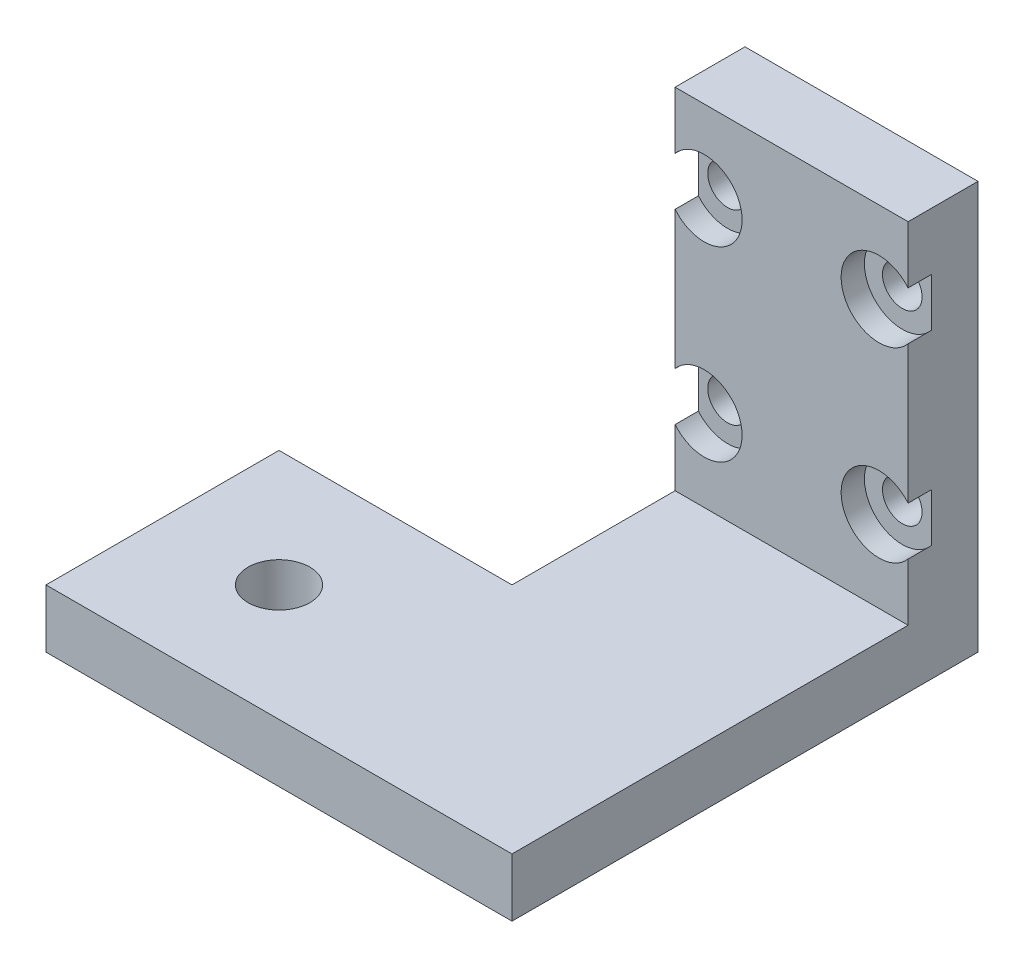
from build123d import *

# Parameters (mm, degrees)
BOSS_EXTRUDE1_DEPTH                                  = 5
SKETCH2_W                                            = 20
SKETCH2_H                                            = 6
BOSS_EXTRUDE2_DEPTH                                  = 30
SKETCH3_R                                            = 1.5
CUT_EXTRUDE1_DEPTH                                   = 50.558046773
REFRENTADO_PARA_TORNILLO_CON_CABEZA_PLAN_D           = 3.4
REFRENTADO_PARA_TORNILLO_CON_CABEZA_PLAN_CBORE_D     = 6.5
REFRENTADO_PARA_TORNILLO_CON_CABEZA_PLAN_CBORE_DEPTH = 2
CUT_EXTRUDE2_REACH                                   = 47
SKETCH7_R                                            = 2.5
TALADRO_DE_MARGEN_PARA_M51_D                         = 5.3
TALADRO_DE_MARGEN_PARA_M51_DEPTH                     = 5
TALADRO_DE_MARGEN_PARA_M51_TIP                       = 1.59228064


with BuildPart() as part:
    # Sketch1 → Boss-Extrude1 (new body)
    with BuildSketch(Plane(origin=(0, 0, 0), x_dir=(1, 0, 0), z_dir=(0, 1, 0))):
        Polygon((0, 0), (-20, 0), (-20, -20), (0, -20), (20, -20), (20, 0), (20, 20), (0, 20), align=None)
    extrude(amount=-BOSS_EXTRUDE1_DEPTH)

    # Sketch2 → Boss-Extrude2 (add)
    with BuildSketch(Plane(origin=(0, 0, 0), x_dir=(1, 0, 0), z_dir=(0, 1, 0))):
        with Locations((10, 17)):
            Rectangle(SKETCH2_W, SKETCH2_H)
    extrude(amount=BOSS_EXTRUDE2_DEPTH)

    # Sketch3 → Cut-Extrude1 (cut, through all)
    with BuildSketch(Plane.XY.offset(-14)):
        with Locations((2.5, 7)):
            Circle(SKETCH3_R)
        with Locations(Location((2.5, 23, 0), (0, 0, 180))):
            Circle(SKETCH3_R)
        with Locations(Location((17.5, 7, 0), (0, 0, 180))):
            Circle(SKETCH3_R)
        with Locations((17.5, 23)):
            Circle(SKETCH3_R)
    extrude(amount=-CUT_EXTRUDE1_DEPTH, mode=Mode.SUBTRACT)

    # Refrentado para tornillo con cabeza plana de M31 (through all)
    with Locations(Plane.XY.offset(-14)):
        with Locations((2.5, 23), (2.5, 7), (17.5, 7), (17.5, 23)):
            CounterBoreHole(REFRENTADO_PARA_TORNILLO_CON_CABEZA_PLAN_D / 2, REFRENTADO_PARA_TORNILLO_CON_CABEZA_PLAN_CBORE_D / 2, REFRENTADO_PARA_TORNILLO_CON_CABEZA_PLAN_CBORE_DEPTH)

    # Sketch7 → Cut-Extrude2 (cut, up to next)
    with BuildSketch(Plane.XZ.offset(5), mode=Mode.PRIVATE) as cut_extrude2_sk1:
        with Locations(Location((-10, 10, 0), (0, 0, 270))):
            Circle(SKETCH7_R)
    cut_extrude2_tool1 = extrude(cut_extrude2_sk1.sketch, amount=-CUT_EXTRUDE2_REACH, mode=Mode.PRIVATE) & part.part
    add(cut_extrude2_tool1.solids().sort_by_distance((-10, -5, 10))[0], mode=Mode.SUBTRACT)

    # Taladro de margen para M51
    with Locations(Plane(origin=(0, -5, 0), x_dir=(-1, 0, 0), z_dir=(0, -1, 0))):
        with Locations((10, -10)):
            Hole(TALADRO_DE_MARGEN_PARA_M51_D / 2, depth=TALADRO_DE_MARGEN_PARA_M51_DEPTH)
            with Locations((0, 0, -(TALADRO_DE_MARGEN_PARA_M51_DEPTH + TALADRO_DE_MARGEN_PARA_M51_TIP / 2))):  # 118° drill point
                Cone(0, TALADRO_DE_MARGEN_PARA_M51_D / 2, TALADRO_DE_MARGEN_PARA_M51_TIP, mode=Mode.SUBTRACT)


solid = part.part
